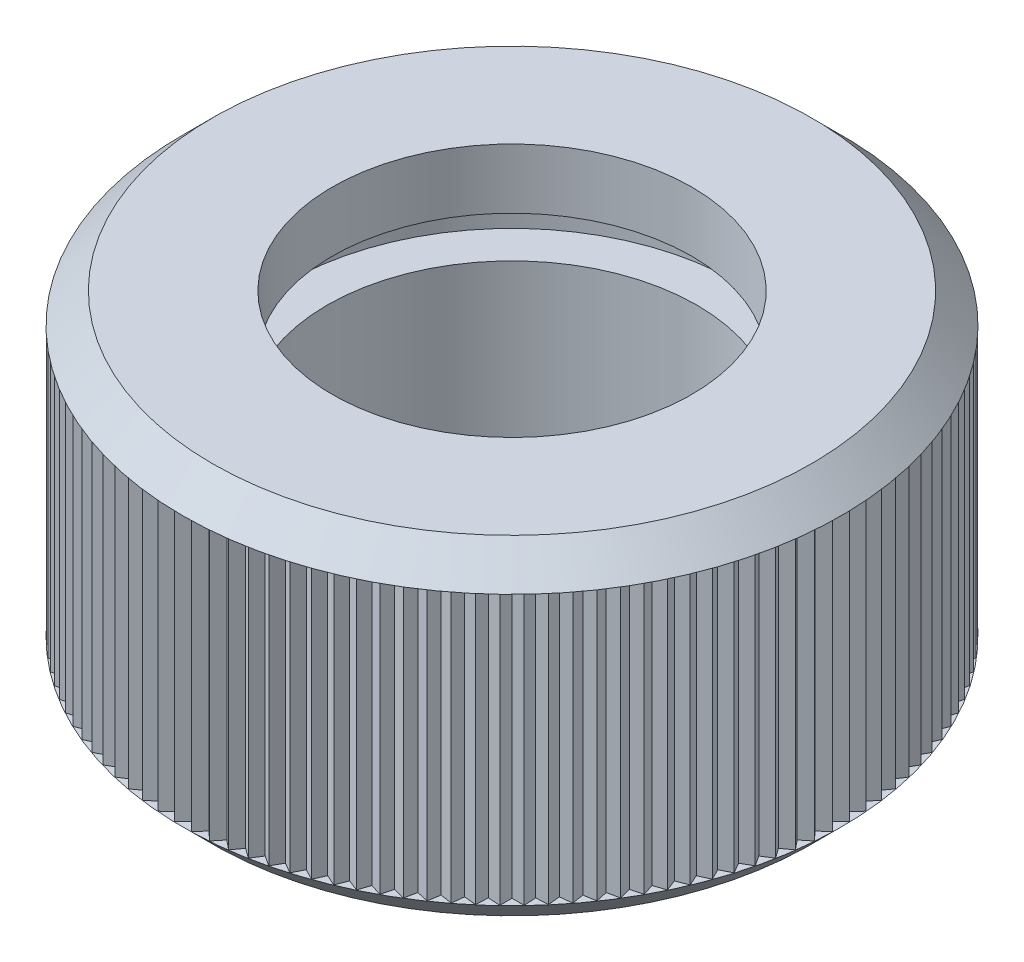
from build123d import *

# Parameters (mm, degrees)
CHAMFER_1_SIZE           = 1
CUT_EXTRUDE_1_DEPTH      = 4.5
PATTERN_CIRCULAR_1_COUNT = 120
SKETCH_5_R               = 6.172
CUT_EXTRUDE_2_DEPTH      = 9
CHAMFER_2_SIZE           = 0.828


with BuildPart() as part:
    # Эскиз1 → Повернуть1 (revolve)
    with BuildSketch(Plane(origin=(0, 0, 0), x_dir=(0, 0, -1), z_dir=(1, 0, 0))):
        Polygon((6, 11), (6, 9), (7.5, 9), (7.5, 7.5), (6, 7.5), (6, 0), (11, 0), (11, 11), align=None)
    revolve(axis=Axis((0, 0, 0), (0, 1, 0)))

    # Фаска1
    chamfer_1_edges = [part.edges().sort_by_distance(p)[0] for p in [
        (0, 11, 11),
        (0, 0, 11),
    ]]
    chamfer(chamfer_1_edges, length=CHAMFER_1_SIZE)

    # Эскиз4 → Вырез-Вытянуть1 (cut, symmetric)
    with BuildSketch(Plane(origin=(0, 5.5, 0), x_dir=(1, 0, 0), z_dir=(0, 1, 0))):
        Polygon((-12.695936985, 0), (-10.695936985, 0), (-12.695936985, 2), align=None)
        Polygon((-12.695936985, -2), (-10.695936985, 0), (-12.695936985, 0), align=None)
    cut_extrude_1 = extrude(amount=CUT_EXTRUDE_1_DEPTH, both=True, mode=Mode.SUBTRACT)

    # Круговой массив1: Вырез-Вытянуть1 ×120 about axis
    pattern_circular_1_axis = Axis((0, 0, 0), (0, 1, 0))
    for i in range(1, PATTERN_CIRCULAR_1_COUNT):
        add(cut_extrude_1.rotate(pattern_circular_1_axis, i * 360 / PATTERN_CIRCULAR_1_COUNT), mode=Mode.SUBTRACT)

    # Эскиз5 → Вырез-Вытянуть2 (cut)
    with BuildSketch(Plane.XZ):
        with Locations(Location((0, 0, 0), (0, 0, 270))):
            Circle(SKETCH_5_R)
    extrude(amount=-CUT_EXTRUDE_2_DEPTH, mode=Mode.SUBTRACT)

    # Фаска2
    chamfer_2_edges = [part.edges().sort_by_distance(p)[0] for p in [
        (0, 0, 6.172),
    ]]
    chamfer(chamfer_2_edges, length=CHAMFER_2_SIZE)


solid = part.part
